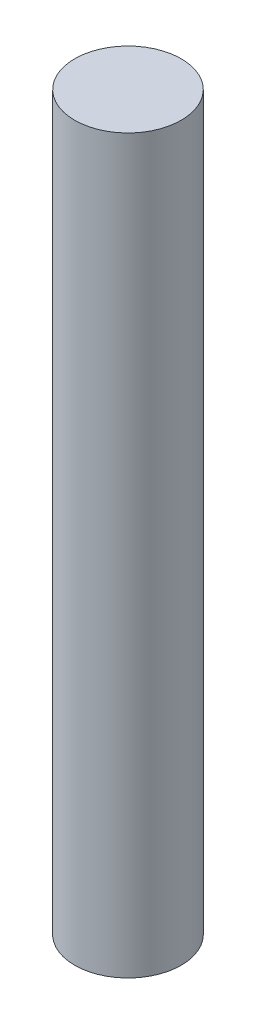
from build123d import *

# Parameters (mm, degrees)
CROQUIS1_R              = 2.475
SALIENTE_EXTRUIR1_DEPTH = 34


with BuildPart() as part:
    # Croquis1 → Saliente-Extruir1 (new body)
    with BuildSketch(Plane(origin=(0, 0, 0), x_dir=(1, 0, 0), z_dir=(0, 1, 0))):
        with Locations(Location((0, 0, 0), (0, 0, 270))):
            Circle(CROQUIS1_R)
    extrude(amount=SALIENTE_EXTRUIR1_DEPTH)


solid = part.part
